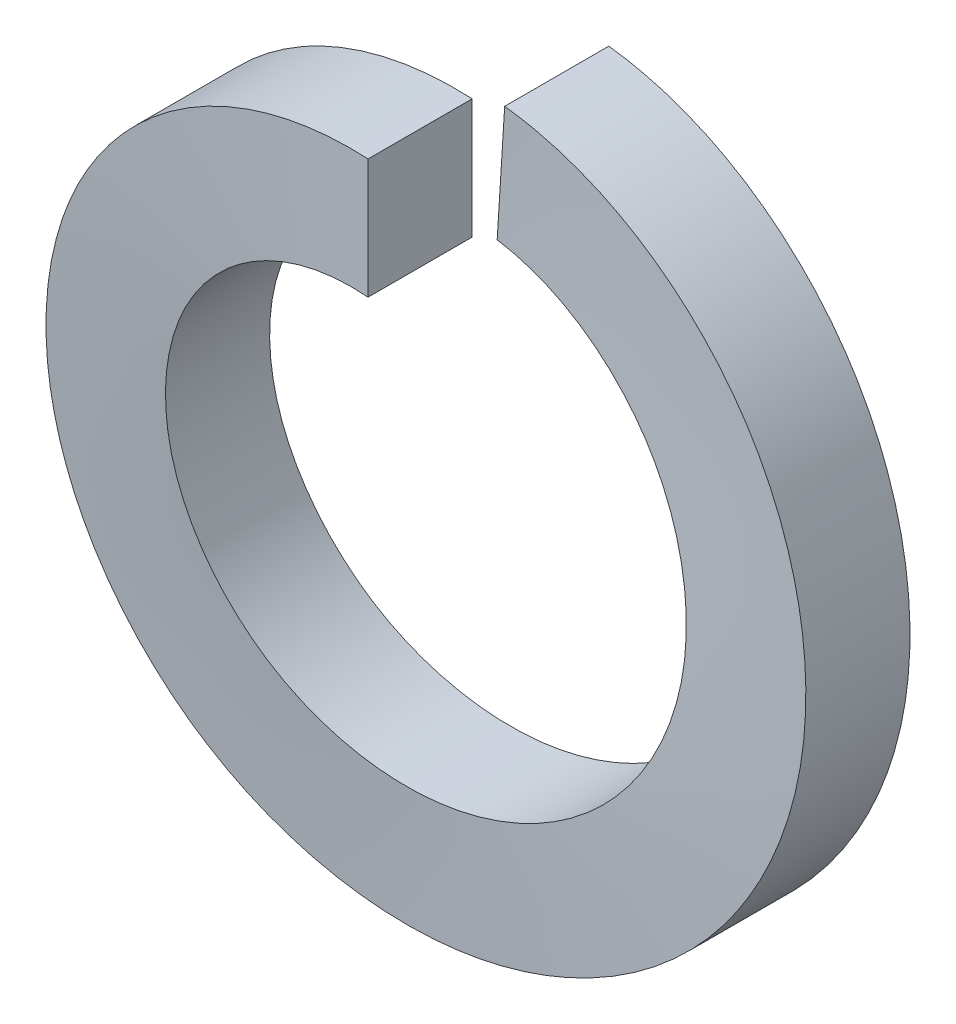
from build123d import *

# Parameters (mm, degrees)
SWEEP1_PITCH       = 0.846666667
SWEEP1_HEIGHT      = 0.8382
SWEEP1_RADIUS      = 2.5654
SWEEP1_START_ANGLE = 90
SKETCH2_W          = 0.762
SKETCH2_H          = 0.8763


with BuildPart() as part:
    # Sweep1: sweep along a helix
    with BuildLine() as sweep1_path:
        add(Helix(SWEEP1_PITCH, SWEEP1_HEIGHT, SWEEP1_RADIUS, center=(0, 0, 0), direction=(0, 0, -1), lefthand=True, mode=Mode.PRIVATE).rotate(Axis((0, 0, 0), (0, 0, -1)), SWEEP1_START_ANGLE))
    # Sketch2 → Sweep1 (sweep)
    with BuildSketch(Plane(origin=(0, 0, 0), x_dir=(0, 0, -1), z_dir=(1, 0, 0))):
        with Locations((-0.381, 2.12725)):
            Rectangle(SKETCH2_W, SKETCH2_H)
    sweep(path=sweep1_path.line, is_frenet=True)


solid = part.part
